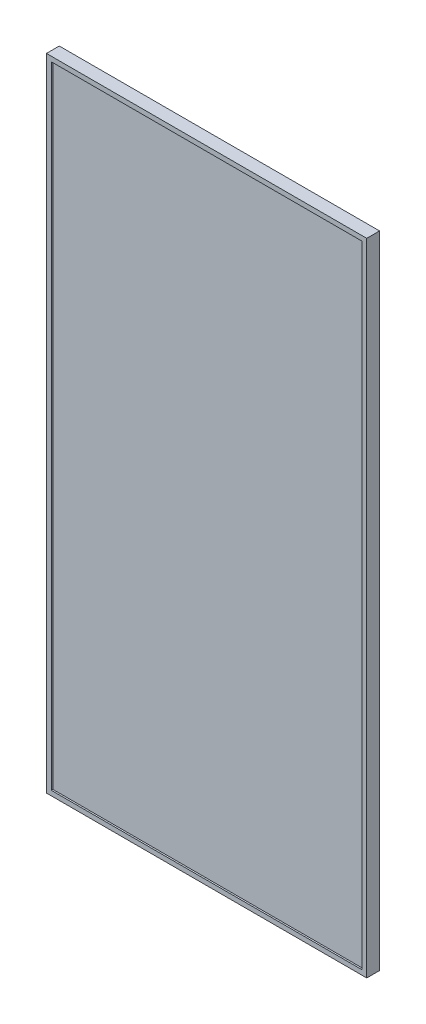
from build123d import *

# Parameters (mm, degrees)
CROQUIS1_W                 = 1000
CROQUIS1_H                 = 2000
SALIENTE_EXTRUIR2_DEPTH    = 40
CROQUIS2_W                 = 940
CROQUIS2_H                 = 1940
CORTAR_EXTRUIR1_DEPTH      = 30
CORTAR_EXTRUIR2_DEPTH      = 495
CORTAR_EXTRUIR2_DEPTH_BACK = 495
CROQUIS3_W                 = 25
CROQUIS3_H                 = 1990
CROQUIS4_W                 = 970
CROQUIS4_H                 = 1970
CORTAR_EXTRUIR3_DEPTH      = 5


with BuildPart() as part:
    # Croquis1 → Saliente-Extruir2 (new body)
    with BuildSketch(Plane.XY):
        Rectangle(CROQUIS1_W, CROQUIS1_H)
    extrude(amount=SALIENTE_EXTRUIR2_DEPTH)

    # Croquis2 → Cortar-Extruir1 (cut)
    with BuildSketch(Plane(origin=(0, 0, 0), x_dir=(-1, 0, 0), z_dir=(0, 0, -1))):
        Rectangle(CROQUIS2_W, CROQUIS2_H)
    extrude(amount=-CORTAR_EXTRUIR1_DEPTH, mode=Mode.SUBTRACT)

    # Croquis3 → Cortar-Extruir2 (cut, two sides: drawn at the far end of the back side and taken through both)
    with BuildSketch(Plane(origin=(0, 0, 0), x_dir=(0, 0, -1), z_dir=(1, 0, 0)).offset(-CORTAR_EXTRUIR2_DEPTH_BACK)):
        with Locations((-17.5, 0)):
            Rectangle(CROQUIS3_W, CROQUIS3_H)
    extrude(amount=CORTAR_EXTRUIR2_DEPTH + CORTAR_EXTRUIR2_DEPTH_BACK, mode=Mode.SUBTRACT)

    # Croquis4 → Cortar-Extruir3 (cut)
    with BuildSketch(Plane.XY.offset(40)):
        Rectangle(CROQUIS4_W, CROQUIS4_H)
    extrude(amount=-CORTAR_EXTRUIR3_DEPTH, mode=Mode.SUBTRACT)


solid = part.part
